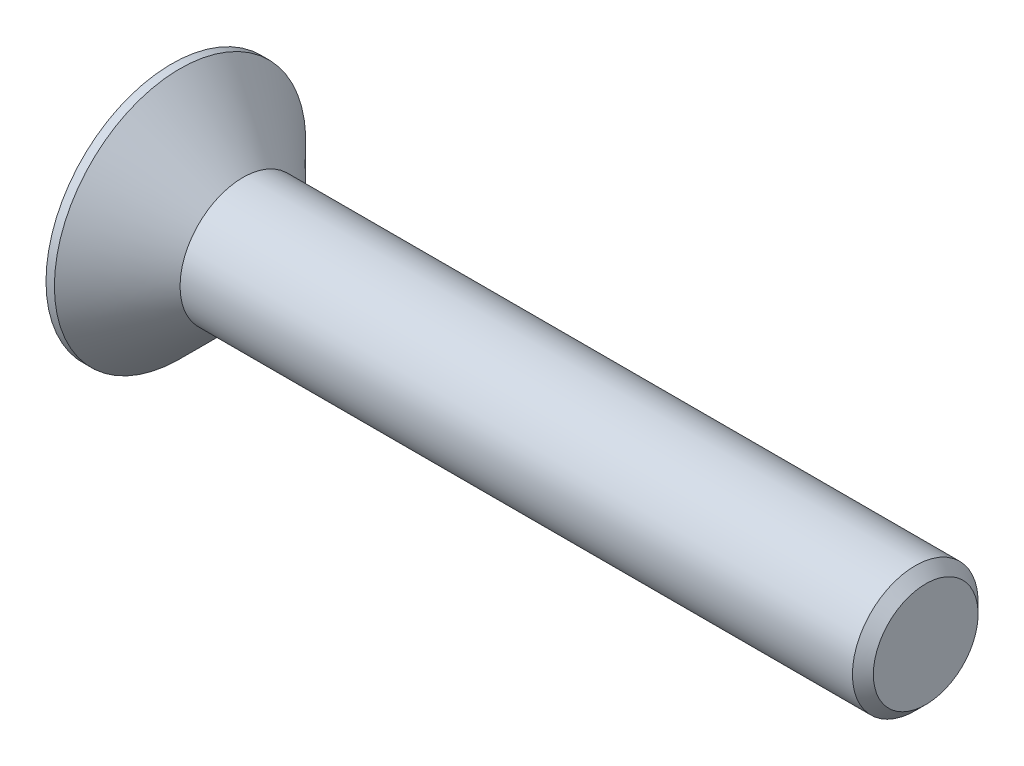
from build123d import *

# Parameters (mm, degrees)
CUT_EXTRUDE1_DEPTH = 0.8


with BuildPart() as part:
    # Sketch2 → Revolve1 (revolve)
    with BuildSketch(Plane.XY, mode=Mode.PRIVATE) as revolve1_sk:
        Polygon((0, 0), (0, 3), (0.2, 3), (1.7, 1.5), (17.75, 1.5), (18, 1.25), (18, 0), align=None)
    revolve(revolve1_sk.sketch.rotate(Axis((-2.281841559, 0, 0), (1, 0, 0)), 90), axis=Axis((-2.281841559, 0, 0), (1, 0, 0)))

    # Sketch3 → Cut-Extrude1 (cut)
    with BuildSketch(Plane.ZY):
        Polygon((0.721687836, -1.25), (1.443375673, 0), (0.721687836, 1.25), (-0.721687836, 1.25), (-1.443375673, 0), (-0.721687836, -1.25), align=None)
    extrude(amount=-CUT_EXTRUDE1_DEPTH, mode=Mode.SUBTRACT)


solid = part.part
